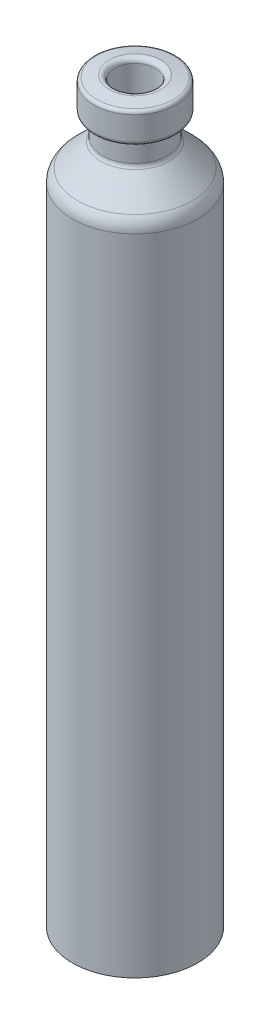
from build123d import *


with BuildPart() as part:
    # Sketch1 → Revolve1 (revolve)
    with BuildSketch(Plane(origin=(0, 0, 0), x_dir=(0, 0, -1), z_dir=(1, 0, 0))):
        with BuildLine():
            Line((0, 0), (0, 56.282769388))
            ThreePointArc((0, 56.282769388), (-0.123261782, 56.898597478), (-0.474055296, 57.419540484))
            Line((-0.474055296, 57.419540484), (-2.47685772, 59.403268599))
            ThreePointArc((-2.47685772, 59.403268599), (-2.586480693, 59.566063288), (-2.625, 59.758509566))
            Line((-2.625, 59.758509566), (-2.625, 61.225538739))
            ThreePointArc((-2.625, 61.225538739), (-2.563006002, 61.408167168), (-2.402645714, 61.515316487))
            Line((-2.402645714, 61.515316487), (-2.122354286, 61.590420349))
            ThreePointArc((-2.122354286, 61.590420349), (-1.961993998, 61.697569668), (-1.9, 61.880198096))
            Line((-1.9, 61.880198096), (-1.9, 63.952814528))
            ThreePointArc((-1.9, 63.952814528), (-1.968512625, 64.143637994), (-2.142757301, 64.247302683))
            Line((-2.142757301, 64.247302683), (-3.223676402, 64.457412072))
            ThreePointArc((-3.223676402, 64.457412072), (-3.554431288, 64.373411032), (-3.7, 64.064761198))
            Line((-3.7, 64.064761198), (-3.7, 59.415776148))
            ThreePointArc((-3.7, 59.415776148), (-3.661480693, 59.22332987), (-3.55185772, 59.060535181))
            Line((-3.55185772, 59.060535181), (-1.324055296, 56.853949923))
            ThreePointArc((-1.324055296, 56.853949923), (-0.973261782, 56.333006917), (-0.85, 55.717178827))
            Line((-0.85, 55.717178827), (-0.85, 0))
            Line((-0.85, 0), (0, 0))
        make_face()
    revolve(axis=Axis((0, 0, 5.475), (0, 1, 0)))


solid = part.part
